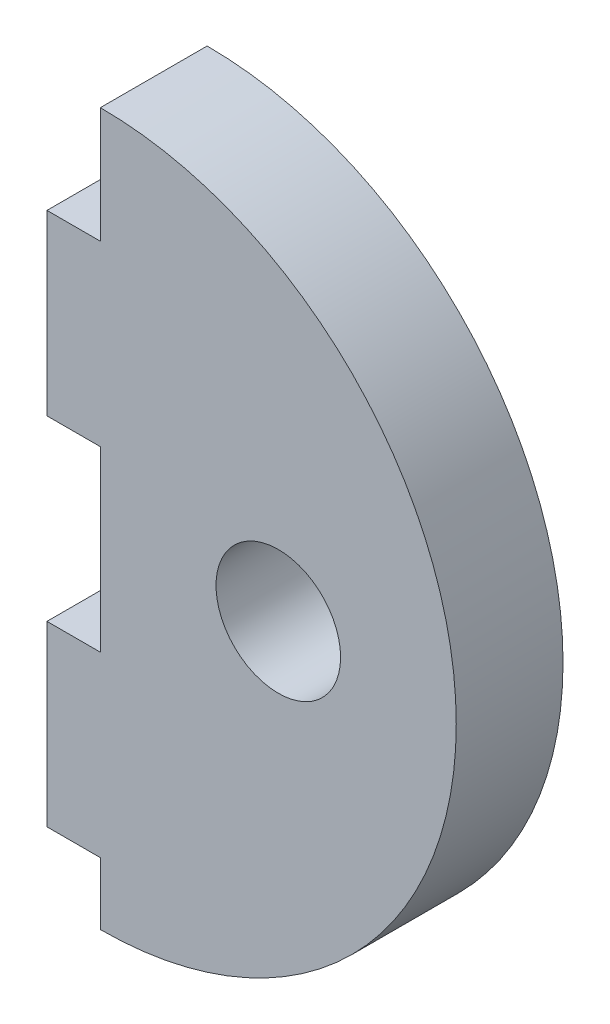
from build123d import *

# Parameters (mm, degrees)
SKETCH1_R           = 3.5
BOSS_EXTRUDE1_DEPTH = 6


with BuildPart() as part:
    # Sketch1 → Boss-Extrude1 (new body)
    with BuildSketch(Plane.XY):
        with BuildLine():
            Line((0, 0), (0, 10))
            Line((0, 10), (3, 10))
            Line((3, 10), (3, 20))
            Line((3, 20), (0, 20))
            Line((0, 20), (0, 30))
            Line((0, 30), (3, 30))
            Line((3, 30), (3, 36.5))
            ThreePointArc((3, 36.5), (23, 16.5), (3, -3.5))
            Line((3, -3.5), (3, 0))
            Line((3, 0), (0, 0))
        make_face()
        with Locations((13, 16.5)):
            Circle(SKETCH1_R, mode=Mode.SUBTRACT)
    extrude(amount=BOSS_EXTRUDE1_DEPTH)


solid = part.part
